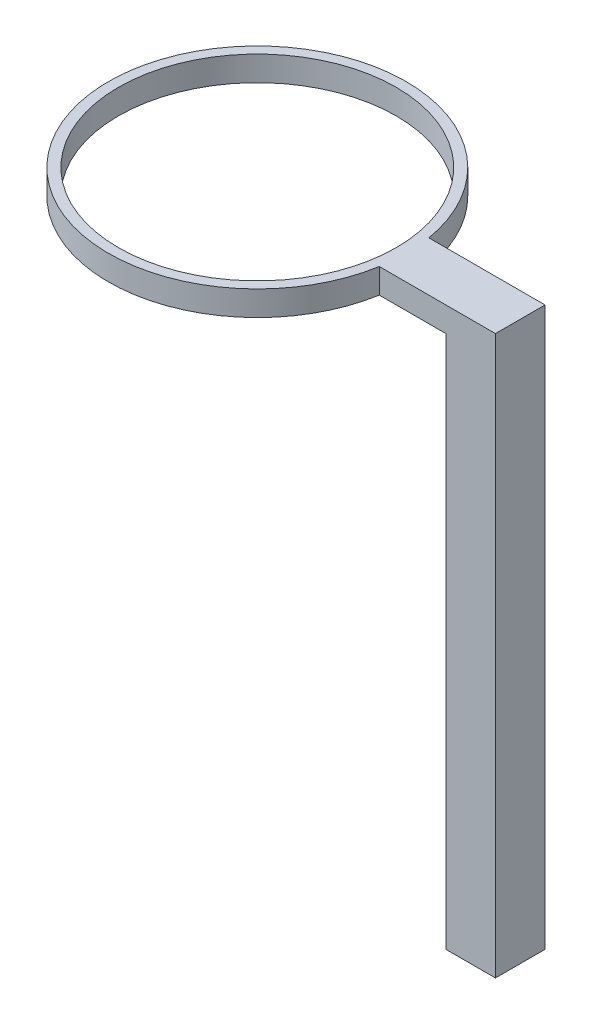
from build123d import *

# Parameters (mm, degrees)
ESQUISSE3_W             = 10
ESQUISSE3_H             = 70
BOSS_EXTRU_1_DEPTH      = 5
ESQUISSE8_R             = 30
ESQUISSE8_R_2           = 28
BOSS_EXTRU_4_DEPTH      = 2.5
ESQUISSE8_W             = 22
ESQUISSE8_H             = 10
BOSS_EXTRU_4_2_DEPTH    = 2.5
BOSS_EXTRU_5_REACH      = 107.494
ESQUISSE9_W             = 10
ESQUISSE9_H             = 10
BOSS_EXTRU_6_REACH      = 133.443
ESQUISSE10_W            = 10
ESQUISSE10_H            = 5
ESQUISSE11_R            = 2
ENL_V_MAT_EXTRU_1_DEPTH = 6


with BuildPart() as part:
    # Esquisse3 → Boss.-Extru.1 (new, symmetric)
    with BuildSketch(Plane.XY):
        with Locations((5, 35)):
            Rectangle(ESQUISSE3_W, ESQUISSE3_H)
    extrude(amount=BOSS_EXTRU_1_DEPTH, both=True)


with BuildPart() as body_2:
    # Esquisse8 → Boss.-Extru.4 (new, symmetric)
    with BuildSketch(Plane(origin=(0, 110, 0), x_dir=(1, 0, 0), z_dir=(0, 1, 0))):
        with Locations(Location((-43, 0, 0), (0, 0, 270))):
            Circle(ESQUISSE8_R)
        with Locations(Location((-43, 0, 0), (0, 0, 270))):
            Circle(ESQUISSE8_R_2, mode=Mode.SUBTRACT)
    extrude(amount=BOSS_EXTRU_4_DEPTH, both=True)

    # Esquisse10 → Boss.-Extru.6 (add, up to next)
    with BuildSketch(Plane.ZY.offset(12), mode=Mode.PRIVATE) as boss_extru_6_sk1:
        with Locations((0, 110)):
            Rectangle(ESQUISSE10_W, ESQUISSE10_H)
    boss_extru_6_tool1 = extrude(boss_extru_6_sk1.sketch, amount=BOSS_EXTRU_6_REACH, mode=Mode.PRIVATE) - body_2.part


with BuildPart() as body_3:
    # Esquisse8 → Boss.-Extru.4 2 (new, symmetric)
    with BuildSketch(Plane(origin=(0, 110, 0), x_dir=(1, 0, 0), z_dir=(0, 1, 0))):
        with Locations((-1, 0)):
            Rectangle(ESQUISSE8_W, ESQUISSE8_H)
    extrude(amount=BOSS_EXTRU_4_2_DEPTH, both=True)

    # Esquisse9 → Boss.-Extru.5 (add, up to next)
    with BuildSketch(Plane(origin=(0, 70, 0), x_dir=(1, 0, 0), z_dir=(0, 1, 0)), mode=Mode.PRIVATE) as boss_extru_5_sk1:
        with Locations((5, 0)):
            Rectangle(ESQUISSE9_W, ESQUISSE9_H)
    boss_extru_5_tool1 = extrude(boss_extru_5_sk1.sketch, amount=BOSS_EXTRU_5_REACH, mode=Mode.PRIVATE) - body_3.part

    add(part.part)  # Boss.-Extru.5 merges part
    add(boss_extru_5_tool1.solids().sort_by_distance((5, 70, 0))[0])


with BuildPart() as body_2_1:
    add(body_2.part)

    add(body_3.part)  # Boss.-Extru.6 merges body 3
    add(boss_extru_6_tool1.solids().sort_by_distance((-12, 110, 0))[0])

    # Esquisse11 → Enlèv. mat.-Extru.1 (cut)
    with BuildSketch(Plane.ZY):
        with Locations((0, 7.5)):
            Circle(ESQUISSE11_R)
    extrude(amount=-ENL_V_MAT_EXTRU_1_DEPTH, mode=Mode.SUBTRACT)


solid = body_2_1.part
